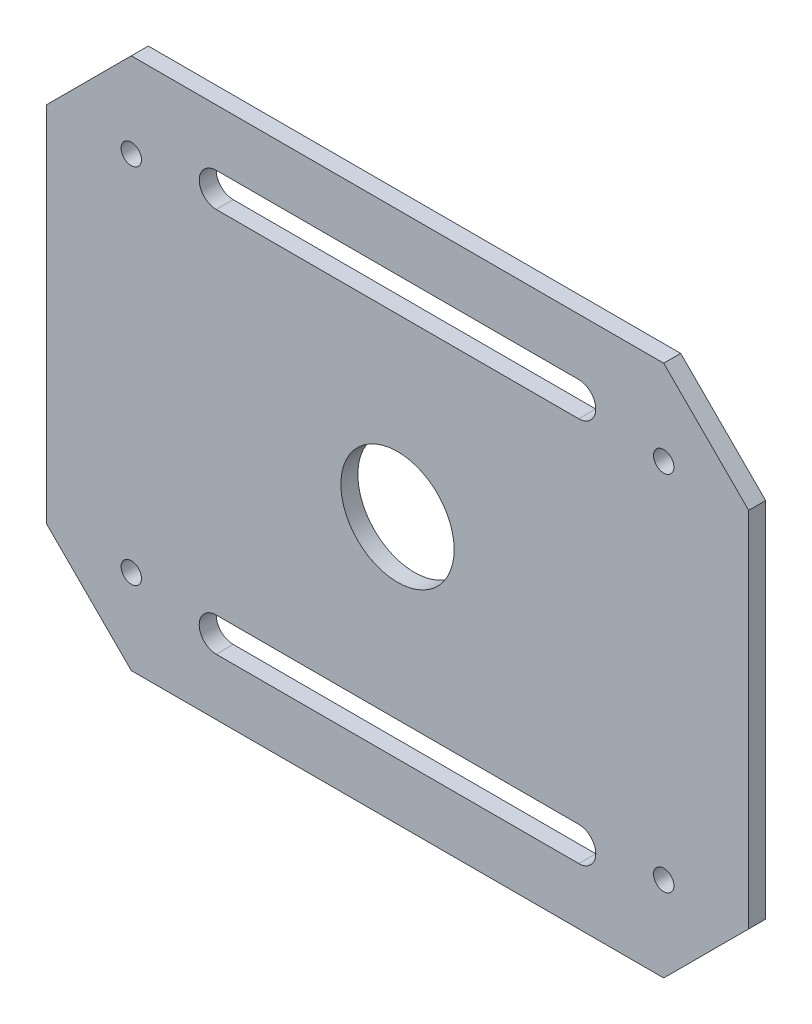
from build123d import *

# Parameters (mm, degrees)
SKETCH1_R           = 1.8
SKETCH1_R_2         = 10
BOSS_EXTRUDE1_DEPTH = 3


with BuildPart() as part:
    # Sketch1 → Boss-Extrude1 (new body)
    with BuildSketch(Plane.XY):
        Polygon((-39.957408855, -43.544565591), (-24.957408855, -28.544565591), (69.042591145, -28.544565591), (84.042591145, -43.544565591), (84.042591145, -107.544565591), (69.042591145, -122.544565591), (-24.957408855, -122.544565591), (-39.957408855, -107.544565591), align=None)
        with Locations((-24.957408855, -43.544565591)):
            Circle(SKETCH1_R, mode=Mode.SUBTRACT)
        with Locations((69.042591145, -43.544565591)):
            Circle(SKETCH1_R, mode=Mode.SUBTRACT)
        with Locations((69.042591145, -107.544565591)):
            Circle(SKETCH1_R, mode=Mode.SUBTRACT)
        with Locations((-24.957408855, -107.544565591)):
            Circle(SKETCH1_R, mode=Mode.SUBTRACT)
        with Locations((22.042591145, -75.544565591)):
            Circle(SKETCH1_R_2, mode=Mode.SUBTRACT)
        with BuildLine():
            Line((-9.957408855, -38.544565591), (54.042591145, -38.544565591))
            ThreePointArc((54.042591145, -38.544565591), (57.042591145, -41.544565591), (54.042591145, -44.544565591))
            Line((54.042591145, -44.544565591), (-9.957408855, -44.544565591))
            ThreePointArc((-9.957408855, -44.544565591), (-12.957408855, -41.544565591), (-9.957408855, -38.544565591))
        make_face(mode=Mode.SUBTRACT)
        with BuildLine():
            Line((-9.965744505, -106.544565591), (54.050926794, -106.544565591))
            ThreePointArc((54.050926794, -106.544565591), (57.050926794, -109.544565591), (54.050926794, -112.544565591))
            Line((54.050926794, -112.544565591), (-9.965744505, -112.544565591))
            ThreePointArc((-9.965744505, -112.544565591), (-12.965744505, -109.544565591), (-9.965744505, -106.544565591))
        make_face(mode=Mode.SUBTRACT)
    extrude(amount=BOSS_EXTRUDE1_DEPTH)


solid = part.part
